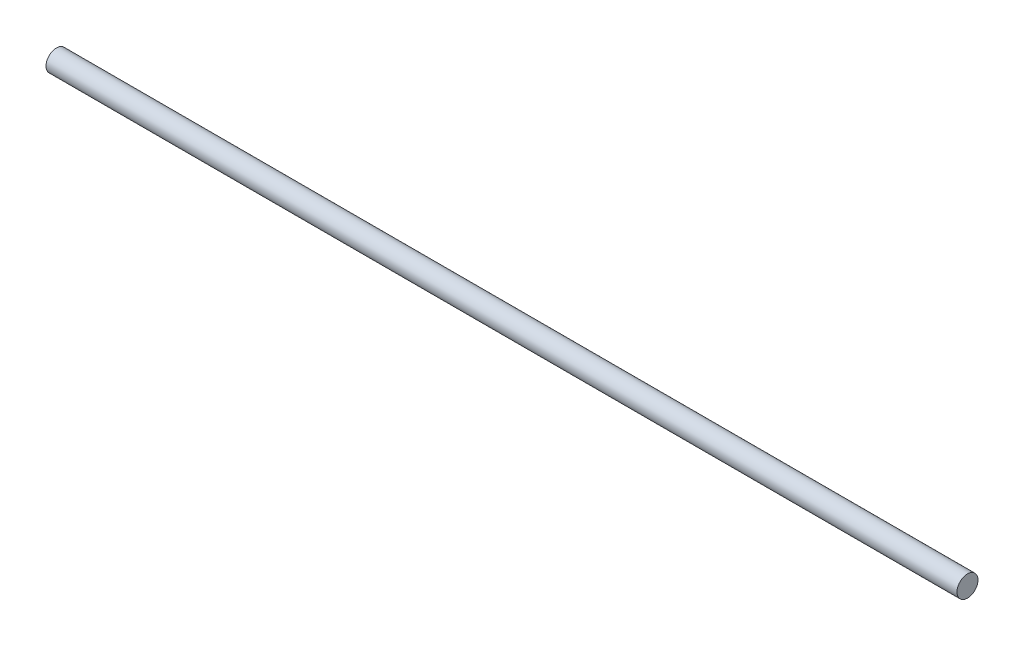
from build123d import *

# Parameters (mm, degrees)
SKETCH1_R           = 3
BOSS_EXTRUDE1_DEPTH = 130


with BuildPart() as part:
    # Sketch1 → Boss-Extrude1 (new, symmetric)
    with BuildSketch(Plane(origin=(0, 0, 0), x_dir=(0, 0, -1), z_dir=(1, 0, 0))):
        Circle(SKETCH1_R)
    extrude(amount=BOSS_EXTRUDE1_DEPTH, both=True)


solid = part.part
